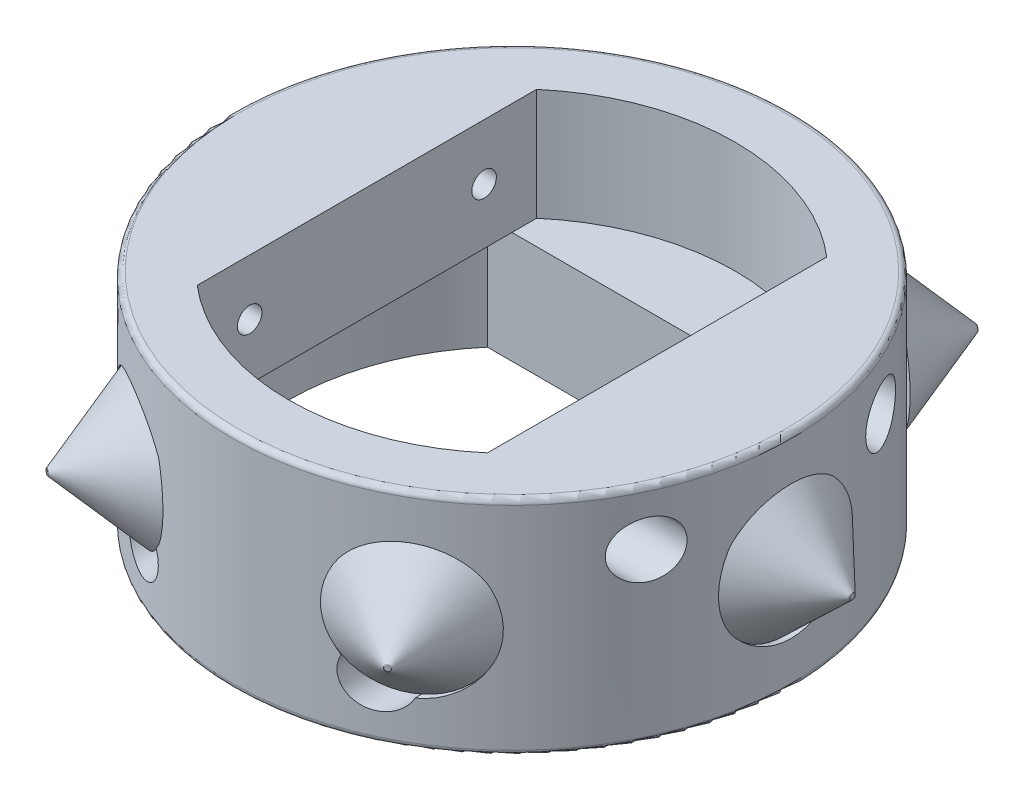
from build123d import *

# Parameters (mm, degrees)
EXTRUDE_1_DEPTH          = 10
EXTRUDE_1_DEPTH_BACK     = 10
SKETCH_1_R               = 25
SKETCH_1_R_2             = 20
FILLET_1_R               = 0.5
PATTERN_CIRCULAR_5_COUNT = 6
SKETCH_3_R               = 4.25
CUT_EXTRUDE_1_DEPTH      = 10
PATTERN_CIRCULAR_6_COUNT = 6
EXTRUDE_2_DEPTH          = 10
CUT_EXTRUDE_2_DEPTH      = 52.924322335
CUT_EXTRUDE_2_DEPTH_BACK = 52.924322335
SKETCH_5_R               = 1.1
EXTRUDE_START            = 10
EXTRUDE_7_DEPTH          = 10
SKETCH_8_R               = 1.1
CUT_EXTRUDE_3_DEPTH      = 51.920889443
SKETCH_9_R               = 6
CUT_EXTRUDE_4_DEPTH      = 62.877986796
PATTERN_CIRCULAR_7_COUNT = 6
SKETCH_11_R              = 2.5
CUT_EXTRUDE_5_DEPTH      = 8
SKETCH_12_R              = 2.5
CUT_EXTRUDE_6_DEPTH      = 8


with BuildPart() as part:
    # ｽｹｯﾁ1 → ﾎﾞｽ - 押し出し1 (new, two sides: drawn at the far end of the back side and taken through both)
    with BuildSketch(Plane(origin=(0, 0, 0), x_dir=(1, 0, 0), z_dir=(0, 1, 0)).offset(-EXTRUDE_1_DEPTH_BACK)):
        with Locations(Location((0, 0, 0), (0, 0, 270))):
            Circle(SKETCH_1_R)
        with Locations(Location((0, 0, 0), (0, 0, 270))):
            Circle(SKETCH_1_R_2, mode=Mode.SUBTRACT)
    extrude(amount=EXTRUDE_1_DEPTH + EXTRUDE_1_DEPTH_BACK)

    # ﾌｨﾚｯﾄ1
    fillet_1_edges = [part.edges().sort_by_distance(p)[0] for p in [
        (0, -10, -25),
        (0, 10, -25),
    ]]
    fillet(fillet_1_edges, radius=FILLET_1_R)

    # ｽｹｯﾁ3 → ｶｯﾄ - 押し出し1 (cut)
    with BuildSketch(Plane(origin=(-12.25, 0, 21.217622393), x_dir=(-0.8660254037844434, 0, -0.49999999999999195), z_dir=(0.49999999999999195, 0, -0.8660254037844434))):
        Circle(SKETCH_3_R)
    cut_extrude_1 = extrude(amount=-CUT_EXTRUDE_1_DEPTH, mode=Mode.SUBTRACT)

    # 円形ﾊﾟﾀｰﾝ6: ｶｯﾄ - 押し出し1 ×6 about axis
    pattern_circular_6_axis = Axis((0, 0, 0), (0, 1, 0))
    for i in range(1, PATTERN_CIRCULAR_6_COUNT):
        add(cut_extrude_1.rotate(pattern_circular_6_axis, i * 360 / PATTERN_CIRCULAR_6_COUNT), mode=Mode.SUBTRACT)

    # ｽｹｯﾁ4 → ﾎﾞｽ - 押し出し2 (add)
    with BuildSketch(Plane.XZ):
        with BuildLine():
            Line((-13, 15.198684154), (-13, -15.198684154))
            ThreePointArc((-13, -15.198684154), (-20, 0), (-13, 15.198684154))
        make_face()
        with BuildLine():
            Line((13, 15.198684154), (13, -15.198684154))
            ThreePointArc((13, -15.198684154), (20, 0), (13, 15.198684154))
        make_face()
    extrude(amount=-EXTRUDE_2_DEPTH)

    # ｽｹｯﾁ5 → ｶｯﾄ - 押し出し2 (cut, two sides: drawn at the far end of the back side and taken through both)
    with BuildSketch(Plane.ZY.offset(-13).offset(-CUT_EXTRUDE_2_DEPTH_BACK)):
        with Locations((10.5, 5)):
            Circle(SKETCH_5_R)
        with Locations((-10.5, 5)):
            Circle(SKETCH_5_R)
    extrude(amount=CUT_EXTRUDE_2_DEPTH + CUT_EXTRUDE_2_DEPTH_BACK, mode=Mode.SUBTRACT)

    # ｽｹｯﾁ7 → ﾎﾞｽ - 押し出し7 (add)
    with BuildSketch(Plane.XZ.offset(EXTRUDE_START)):
        with BuildLine():
            Line((15.198684154, -13), (-15.198684154, -13))
            ThreePointArc((-15.198684154, -13), (0, -20), (15.198684154, -13))
        make_face()
        with BuildLine():
            Line((15.198684154, 13), (-15.198684154, 13))
            ThreePointArc((-15.198684154, 13), (0, 20), (15.198684154, 13))
        make_face()
    extrude(amount=-EXTRUDE_7_DEPTH)

    # ｽｹｯﾁ8 → ｶｯﾄ - 押し出し3 (cut, through all)
    with BuildSketch(Plane(origin=(0, 0, 13), x_dir=(-1, 0, 0), z_dir=(0, 0, -1))):
        with Locations((10.5, -5)):
            Circle(SKETCH_8_R)
        with Locations((-10.5, -5)):
            Circle(SKETCH_8_R)
    extrude(amount=-CUT_EXTRUDE_3_DEPTH, mode=Mode.SUBTRACT)

    # ｽｹｯﾁ9 → ｶｯﾄ - 押し出し4 (cut, through all)
    with BuildSketch(Plane(origin=(-24.5, 0, 0), x_dir=(0, 0, -1), z_dir=(1, 0, 0))):
        Circle(SKETCH_9_R)
    cut_extrude_4 = extrude(amount=-CUT_EXTRUDE_4_DEPTH, mode=Mode.SUBTRACT)

    # 円形ﾊﾟﾀｰﾝ7: ｶｯﾄ - 押し出し4 ×6 about axis
    pattern_circular_7_axis = Axis((0, -10, 0), (0, 1, 0))
    for i in range(1, PATTERN_CIRCULAR_7_COUNT):
        add(cut_extrude_4.rotate(pattern_circular_7_axis, i * 360 / PATTERN_CIRCULAR_7_COUNT), mode=Mode.SUBTRACT)

    # ｽｹｯﾁ11 → ｶｯﾄ - 押し出し5 (cut)
    with BuildSketch(Plane.XY.offset(25)):
        with Locations((10.5, -5)):
            Circle(SKETCH_11_R)
        with Locations((-10.5, -5)):
            Circle(SKETCH_11_R)
    cut_extrude_5 = extrude(amount=-CUT_EXTRUDE_5_DEPTH, mode=Mode.SUBTRACT)

    # ﾐﾗｰ1: ｶｯﾄ - 押し出し5 across plane
    add(cut_extrude_5.mirror(Plane.XY), mode=Mode.SUBTRACT)

    # ｽｹｯﾁ12 → ｶｯﾄ - 押し出し6 (cut)
    with BuildSketch(Plane(origin=(25, 0, 0), x_dir=(0, 0, -1), z_dir=(1, 0, 0))):
        with Locations((10.5, 5)):
            Circle(SKETCH_12_R)
        with Locations((-10.5, 5)):
            Circle(SKETCH_12_R)
    cut_extrude_6 = extrude(amount=-CUT_EXTRUDE_6_DEPTH, mode=Mode.SUBTRACT)

    # ﾐﾗｰ2: ｶｯﾄ - 押し出し6 across plane
    add(cut_extrude_6.mirror(Plane(origin=(0, 0, 0), x_dir=(0, 0, 1), z_dir=(1, 0, 0))), mode=Mode.SUBTRACT)


with BuildPart() as body_2:
    # ｽｹｯﾁ2 → 回転1 (revolve)
    with BuildSketch(Plane.XY):
        with BuildLine():
            Line((30.469190536, 0.279525736), (24.5, 6))
            Line((24.5, 6), (24.5, 0))
            Line((24.5, 0), (30.5, 0))
            Line((30.5, 0), (30.5, 0.207326916))
            ThreePointArc((30.5, 0.207326916), (30.491975686, 0.246575778), (30.469190536, 0.279525736))
        make_face()
    revolve(axis=Axis((30.5, 0, 0), (-1, 0, 0)))


with BuildPart() as pattern_circular_5_1:
    # 円形ﾊﾟﾀｰﾝ5: pattern copy
    add(body_2.part.rotate(Axis((0, 0, 0), (0, 1, 0)), 1 * 360 / PATTERN_CIRCULAR_5_COUNT))


with BuildPart() as pattern_circular_5_2:
    # 円形ﾊﾟﾀｰﾝ5: pattern copy
    add(body_2.part.rotate(Axis((0, 0, 0), (0, 1, 0)), 2 * 360 / PATTERN_CIRCULAR_5_COUNT))


with BuildPart() as pattern_circular_5_3:
    # 円形ﾊﾟﾀｰﾝ5: pattern copy
    add(body_2.part.rotate(Axis((0, 0, 0), (0, 1, 0)), 3 * 360 / PATTERN_CIRCULAR_5_COUNT))


with BuildPart() as pattern_circular_5_4:
    # 円形ﾊﾟﾀｰﾝ5: pattern copy
    add(body_2.part.rotate(Axis((0, 0, 0), (0, 1, 0)), 4 * 360 / PATTERN_CIRCULAR_5_COUNT))


with BuildPart() as pattern_circular_5_5:
    # 円形ﾊﾟﾀｰﾝ5: pattern copy
    add(body_2.part.rotate(Axis((0, 0, 0), (0, 1, 0)), 5 * 360 / PATTERN_CIRCULAR_5_COUNT))


solid = Compound([part.part, body_2.part, pattern_circular_5_1.part, pattern_circular_5_2.part, pattern_circular_5_3.part, pattern_circular_5_4.part, pattern_circular_5_5.part])
